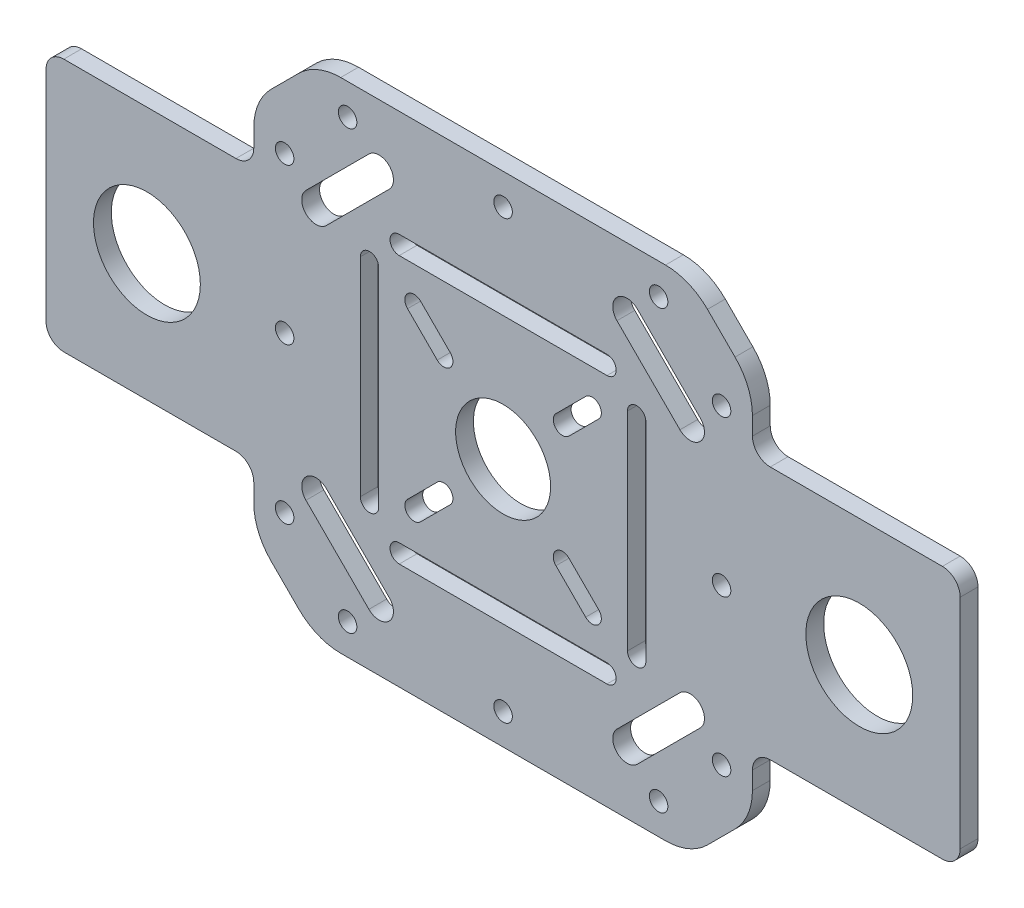
from build123d import *

# Parameters (mm, degrees)
SKETCH_1_R      = 8
SKETCH_1_R_2    = 1.56
SKETCH_1_R_3    = 9
EXTRUDE_1_DEPTH = 3


with BuildPart() as part:
    # 草图1 → 凸台-拉伸1 (new body)
    with BuildSketch(Plane.XY):
        with BuildLine():
            Line((-27.357864376, 42), (27.357864376, 42))
            ThreePointArc((27.357864376, 42), (31.1846987, 41.238795325), (34.428932188, 39.071067812))
            Line((34.428932188, 39.071067812), (39.071067812, 34.428932188))
            ThreePointArc((39.071067812, 34.428932188), (41.238795325, 31.1846987), (42, 27.357864376))
            Line((42, 27.357864376), (42, 24.357864376))
            ThreePointArc((42, 24.357864376), (42.878679656, 22.236544033), (45, 21.357864376))
            Line((45, 21.357864376), (74, 21.357864376))
            ThreePointArc((74, 21.357864376), (76.121320344, 20.47918472), (77, 18.357864376))
            Line((77, 18.357864376), (77, -18.357864376))
            ThreePointArc((77, -18.357864376), (76.121320344, -20.47918472), (74, -21.357864376))
            Line((74, -21.357864376), (45, -21.357864376))
            ThreePointArc((45, -21.357864376), (42.878679656, -22.236544033), (42, -24.357864376))
            Line((42, -24.357864376), (42, -27.357864376))
            ThreePointArc((42, -27.357864376), (41.238795325, -31.1846987), (39.071067812, -34.428932188))
            Line((39.071067812, -34.428932188), (34.428932188, -39.071067812))
            ThreePointArc((34.428932188, -39.071067812), (31.1846987, -41.238795325), (27.357864376, -42))
            Line((27.357864376, -42), (-27.357864376, -42))
            ThreePointArc((-27.357864376, -42), (-31.1846987, -41.238795325), (-34.428932188, -39.071067812))
            Line((-34.428932188, -39.071067812), (-39.071067812, -34.428932188))
            ThreePointArc((-39.071067812, -34.428932188), (-41.238795325, -31.1846987), (-42, -27.357864376))
            Line((-42, -27.357864376), (-42, -24.357864376))
            ThreePointArc((-42, -24.357864376), (-42.878679656, -22.236544033), (-45, -21.357864376))
            Line((-45, -21.357864376), (-74, -21.357864376))
            ThreePointArc((-74, -21.357864376), (-76.121320344, -20.47918472), (-77, -18.357864376))
            Line((-77, -18.357864376), (-77, 18.357864376))
            ThreePointArc((-77, 18.357864376), (-76.121320344, 20.47918472), (-74, 21.357864376))
            Line((-74, 21.357864376), (-45, 21.357864376))
            ThreePointArc((-45, 21.357864376), (-42.878679656, 22.236544033), (-42, 24.357864376))
            Line((-42, 24.357864376), (-42, 27.357864376))
            ThreePointArc((-42, 27.357864376), (-41.238795325, 31.1846987), (-39.071067812, 34.428932188))
            Line((-39.071067812, 34.428932188), (-34.428932188, 39.071067812))
            ThreePointArc((-34.428932188, 39.071067812), (-31.1846987, 41.238795325), (-27.357864376, 42))
        make_face()
        Circle(SKETCH_1_R, mode=Mode.SUBTRACT)
        with Locations((-26.196699141, 36.803300859)):
            Circle(SKETCH_1_R_2, mode=Mode.SUBTRACT)
        with Locations((-36.803300859, 26.196699141)):
            Circle(SKETCH_1_R_2, mode=Mode.SUBTRACT)
        with Locations(Location((26.196699141, 36.803300859, 0), (0, 0, 180))):
            Circle(SKETCH_1_R_2, mode=Mode.SUBTRACT)
        with Locations(Location((36.803300859, 26.196699141, 0), (0, 0, 180))):
            Circle(SKETCH_1_R_2, mode=Mode.SUBTRACT)
        with Locations((36.803300859, -26.196699141)):
            Circle(SKETCH_1_R_2, mode=Mode.SUBTRACT)
        with Locations((26.196699141, -36.803300859)):
            Circle(SKETCH_1_R_2, mode=Mode.SUBTRACT)
        with Locations(Location((-26.196699141, -36.803300859, 0), (0, 0, 180))):
            Circle(SKETCH_1_R_2, mode=Mode.SUBTRACT)
        with Locations(Location((-36.803300859, -26.196699141, 0), (0, 0, 180))):
            Circle(SKETCH_1_R_2, mode=Mode.SUBTRACT)
        with Locations((0, 36.803300859)):
            Circle(SKETCH_1_R_2, mode=Mode.SUBTRACT)
        with Locations(Location((36.803300859, 0, 0), (0, 0, 180))):
            Circle(SKETCH_1_R_2, mode=Mode.SUBTRACT)
        with Locations(Location((0, -36.803300859, 0), (0, 0, 180))):
            Circle(SKETCH_1_R_2, mode=Mode.SUBTRACT)
        with Locations((-36.803300859, 0)):
            Circle(SKETCH_1_R_2, mode=Mode.SUBTRACT)
        with Locations((-60, 0)):
            Circle(SKETCH_1_R_3, mode=Mode.SUBTRACT)
        with Locations((60, 0)):
            Circle(SKETCH_1_R_3, mode=Mode.SUBTRACT)
        with BuildLine():
            Line((-17.5, 24.05), (17.5, 24.05))
            ThreePointArc((17.5, 24.05), (19.05, 22.5), (17.5, 20.95))
            Line((17.5, 20.95), (-17.5, 20.95))
            ThreePointArc((-17.5, 20.95), (-19.05, 22.5), (-17.5, 24.05))
        make_face(mode=Mode.SUBTRACT)
        with BuildLine():
            Line((-17.5, -24.05), (17.5, -24.05))
            ThreePointArc((17.5, -24.05), (19.05, -22.5), (17.5, -20.95))
            Line((17.5, -20.95), (-17.5, -20.95))
            ThreePointArc((-17.5, -20.95), (-19.05, -22.5), (-17.5, -24.05))
        make_face(mode=Mode.SUBTRACT)
        with BuildLine():
            Line((24.05, -17.5), (24.05, 17.5))
            ThreePointArc((24.05, 17.5), (22.5, 19.05), (20.95, 17.5))
            Line((20.95, 17.5), (20.95, -17.5))
            ThreePointArc((20.95, -17.5), (22.5, -19.05), (24.05, -17.5))
        make_face(mode=Mode.SUBTRACT)
        with BuildLine():
            Line((-24.05, -17.5), (-24.05, 17.5))
            ThreePointArc((-24.05, 17.5), (-22.5, 19.05), (-20.95, 17.5))
            Line((-20.95, 17.5), (-20.95, -17.5))
            ThreePointArc((-20.95, -17.5), (-22.5, -19.05), (-24.05, -17.5))
        make_face(mode=Mode.SUBTRACT)
        with BuildLine():
            Line((8.903984489, 11.096015511), (13.903984489, 16.096015511))
            ThreePointArc((13.903984489, 16.096015511), (16.096015511, 16.096015511), (16.096015511, 13.903984489))
            Line((16.096015511, 13.903984489), (11.096015511, 8.903984489))
            ThreePointArc((11.096015511, 8.903984489), (8.903984489, 8.903984489), (8.903984489, 11.096015511))
        make_face(mode=Mode.SUBTRACT)
        with BuildLine():
            Line((-8.903984489, 11.096015511), (-13.903984489, 16.096015511))
            ThreePointArc((-13.903984489, 16.096015511), (-16.096015511, 16.096015511), (-16.096015511, 13.903984489))
            Line((-16.096015511, 13.903984489), (-11.096015511, 8.903984489))
            ThreePointArc((-11.096015511, 8.903984489), (-8.903984489, 8.903984489), (-8.903984489, 11.096015511))
        make_face(mode=Mode.SUBTRACT)
        with BuildLine():
            Line((-8.903984489, -11.096015511), (-13.903984489, -16.096015511))
            ThreePointArc((-13.903984489, -16.096015511), (-16.096015511, -16.096015511), (-16.096015511, -13.903984489))
            Line((-16.096015511, -13.903984489), (-11.096015511, -8.903984489))
            ThreePointArc((-11.096015511, -8.903984489), (-8.903984489, -8.903984489), (-8.903984489, -11.096015511))
        make_face(mode=Mode.SUBTRACT)
        with BuildLine():
            Line((8.903984489, -11.096015511), (13.903984489, -16.096015511))
            ThreePointArc((13.903984489, -16.096015511), (16.096015511, -16.096015511), (16.096015511, -13.903984489))
            Line((16.096015511, -13.903984489), (11.096015511, -8.903984489))
            ThreePointArc((11.096015511, -8.903984489), (8.903984489, -8.903984489), (8.903984489, -11.096015511))
        make_face(mode=Mode.SUBTRACT)
        with BuildLine():
            Line((-33.211093213, 22.604491495), (-22.604491495, 33.211093213))
            ThreePointArc((-22.604491495, 33.211093213), (-19.18230507, 33.211093213), (-19.18230507, 29.788906787))
            Line((-19.18230507, 29.788906787), (-29.788906787, 19.18230507))
            ThreePointArc((-29.788906787, 19.18230507), (-33.211093213, 19.18230507), (-33.211093213, 22.604491495))
        make_face(mode=Mode.SUBTRACT)
        with BuildLine():
            Line((33.211093213, 22.604491495), (22.604491495, 33.211093213))
            ThreePointArc((22.604491495, 33.211093213), (19.18230507, 33.211093213), (19.18230507, 29.788906787))
            Line((19.18230507, 29.788906787), (29.788906787, 19.18230507))
            ThreePointArc((29.788906787, 19.18230507), (33.211093213, 19.18230507), (33.211093213, 22.604491495))
        make_face(mode=Mode.SUBTRACT)
        with BuildLine():
            Line((-33.211093213, -22.604491495), (-22.604491495, -33.211093213))
            ThreePointArc((-22.604491495, -33.211093213), (-19.18230507, -33.211093213), (-19.18230507, -29.788906787))
            Line((-19.18230507, -29.788906787), (-29.788906787, -19.18230507))
            ThreePointArc((-29.788906787, -19.18230507), (-33.211093213, -19.18230507), (-33.211093213, -22.604491495))
        make_face(mode=Mode.SUBTRACT)
        with BuildLine():
            Line((33.211093213, -22.604491495), (22.604491495, -33.211093213))
            ThreePointArc((22.604491495, -33.211093213), (19.18230507, -33.211093213), (19.18230507, -29.788906787))
            Line((19.18230507, -29.788906787), (29.788906787, -19.18230507))
            ThreePointArc((29.788906787, -19.18230507), (33.211093213, -19.18230507), (33.211093213, -22.604491495))
        make_face(mode=Mode.SUBTRACT)
    extrude(amount=EXTRUDE_1_DEPTH)


solid = part.part
